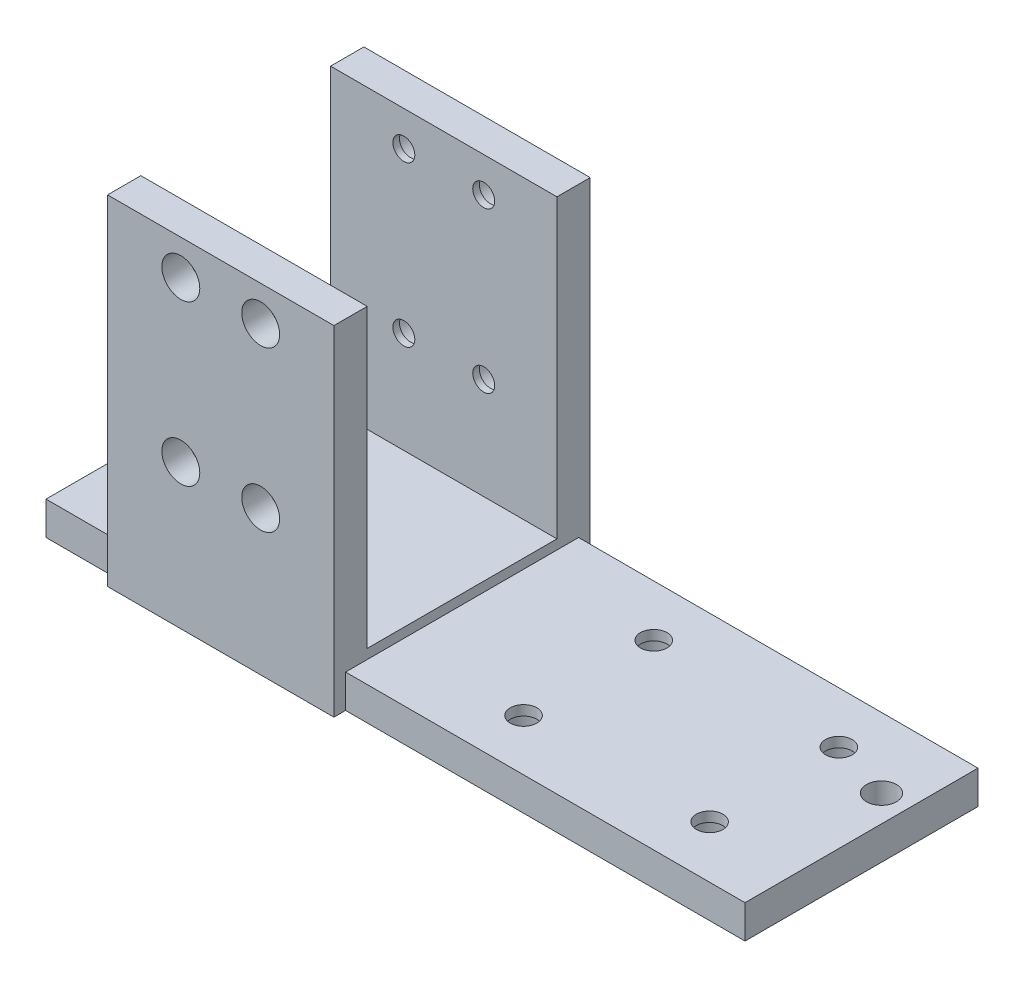
from build123d import *

# Parameters (mm, degrees)
SKETCH1_W                                      = 105
SKETCH1_H                                      = 35
BOSS_EXTRUDE1_DEPTH                            = 5
M4_CLEARANCE_HOLE1_D                           = 4.5
SKETCH4_W                                      = 33.2
SKETCH4_H                                      = 35
BOSS_EXTRUDE2_DEPTH                            = 1.45
BOSS_EXTRUDE3_DEPTH                            = 17
CBORE_FOR_M2_5_SHCS1_AT_2_COUNT                = 2
CBORE_FOR_M2_5_SHCS1_AT_2_PITCH                = 12
CBORE_FOR_M2_5_SHCS1_AT_3_COUNT                = 2
CBORE_FOR_M2_5_SHCS1_AT_3_PITCH                = 24
CBORE_FOR_M2_5_SHCS1_AT_4_COUNT                = 2
CBORE_FOR_M2_5_SHCS1_AT_4_PITCH                = 26.83281573
BOSS_EXTRUDE5_DEPTH                            = 0.4
BOSS_EXTRUDE6_DEPTH                            = 0.4
CBORE_FOR_6_SOCKET_HEAD_CAP_SCREW1_D           = 3.997300108
CBORE_FOR_6_SOCKET_HEAD_CAP_SCREW1_CBORE_D     = 7.345020108
CBORE_FOR_6_SOCKET_HEAD_CAP_SCREW1_CBORE_DEPTH = 3.5052


with BuildPart() as part:
    # Sketch1 → Boss-Extrude1 (new body)
    with BuildSketch(Plane(origin=(0, 0, 0), x_dir=(1, 0, 0), z_dir=(0, 1, 0))):
        Rectangle(SKETCH1_W, SKETCH1_H)
    extrude(amount=BOSS_EXTRUDE1_DEPTH)

    # M4 Clearance Hole1 (through all)
    with Locations(Plane(origin=(0, 5, 0), x_dir=(1, 0, 0), z_dir=(0, 1, 0))):
        with Locations((-48.5, 7), (48.5, 7)):
            Hole(M4_CLEARANCE_HOLE1_D / 2)

    # Sketch4 → Boss-Extrude2 (add)
    with BuildSketch(Plane(origin=(0, 5, 0), x_dir=(1, 0, 0), z_dir=(0, 1, 0))):
        with Locations((-24.5, 0)):
            Rectangle(SKETCH4_W, SKETCH4_H)
    extrude(amount=BOSS_EXTRUDE2_DEPTH)

    # Sketch5 → Boss-Extrude3 (add, symmetric)
    with BuildSketch(Plane.ZY.offset(24.5)):
        Polygon((-17.5, 0), (-19.25, 0), (-19.25, 50.95), (-14.25, 50.95), (-14.25, 6.45), (-17.5, 6.45), align=None)
    boss_extrude3 = extrude(amount=BOSS_EXTRUDE3_DEPTH, both=True)

    # Sketch9 → CBORE for M2.5 SHCS1 (revolve, cut)
    with BuildSketch(Plane(origin=(-30.5, 45.7, -19.25), x_dir=(0, 1, 0), z_dir=(1, 0, 0))):
        Polygon((0, 0), (0, 34.490420021), (1.65, 33.499), (1.65, 4), (2.85, 4), (2.85, 0), align=None)
    cbore_for_m2_5_shcs1 = revolve(axis=Axis((-30.5, 45.7, -25.6), (0, 0, 1)), mode=Mode.SUBTRACT)

    # CBORE for M2.5 SHCS1 at 2: CBORE for M2.5 SHCS1 ×2
    with Locations(*[(i * CBORE_FOR_M2_5_SHCS1_AT_2_PITCH, 0, 0) for i in range(1, CBORE_FOR_M2_5_SHCS1_AT_2_COUNT)]):
        add(cbore_for_m2_5_shcs1, mode=Mode.SUBTRACT)

    # CBORE for M2.5 SHCS1 at 3: CBORE for M2.5 SHCS1 ×2
    with Locations(*[(0, -i * CBORE_FOR_M2_5_SHCS1_AT_3_PITCH, 0) for i in range(1, CBORE_FOR_M2_5_SHCS1_AT_3_COUNT)]):
        add(cbore_for_m2_5_shcs1, mode=Mode.SUBTRACT)

    # CBORE for M2.5 SHCS1 at 4: CBORE for M2.5 SHCS1 ×2
    with Locations(*[Vector(0.44721359549995815, -0.8944271909999159, 0) * (i * CBORE_FOR_M2_5_SHCS1_AT_4_PITCH) for i in range(1, CBORE_FOR_M2_5_SHCS1_AT_4_COUNT)]):
        add(cbore_for_m2_5_shcs1, mode=Mode.SUBTRACT)

    # Mirror1: Boss-Extrude3, CBORE for M2.5 SHCS1 across plane
    add(boss_extrude3.mirror(Plane(origin=(0, 0, 0), x_dir=(1, 0, 0), z_dir=(0, 0, -1))))
    add(cbore_for_m2_5_shcs1.mirror(Plane(origin=(0, 0, 0), x_dir=(1, 0, 0), z_dir=(0, 0, -1))), mode=Mode.SUBTRACT)

    # Mirror1 copy 1 sketch → Mirror1 copy 1 (revolve, cut)
    with BuildSketch(Plane(origin=(-18.5, 45.7, 19.25), x_dir=(0, 1, 0), z_dir=(1, 0, 0))):
        Polygon((0, 0), (0, -34.490420021), (1.65, -33.499), (1.65, -4), (2.85, -4), (2.85, 0), align=None)
    revolve(axis=Axis((-18.5, 45.7, 25.6), (0, 0, 1)), mode=Mode.SUBTRACT)

    # Mirror1 copy 2 sketch → Mirror1 copy 2 (revolve, cut)
    with BuildSketch(Plane(origin=(-30.5, 21.7, 19.25), x_dir=(0, 1, 0), z_dir=(1, 0, 0))):
        Polygon((0, 0), (0, -34.490420021), (1.65, -33.499), (1.65, -4), (2.85, -4), (2.85, 0), align=None)
    revolve(axis=Axis((-30.5, 21.7, 25.6), (0, 0, 1)), mode=Mode.SUBTRACT)

    # Mirror1 copy 3 sketch → Mirror1 copy 3 (revolve, cut)
    with BuildSketch(Plane(origin=(-18.5, 21.7, 19.25), x_dir=(0, 1, 0), z_dir=(1, 0, 0))):
        Polygon((0, 0), (0, -34.490420021), (1.65, -33.499), (1.65, -4), (2.85, -4), (2.85, 0), align=None)
    revolve(axis=Axis((-18.5, 21.7, 25.6), (0, 0, 1)), mode=Mode.SUBTRACT)

    # Sketch11 → Boss-Extrude5 (add)
    with BuildSketch(Plane(origin=(-7.9, 0, 0), x_dir=(0, 0, -1), z_dir=(1, 0, 0))):
        Polygon((17.5, 5), (17.5, 6.45), (14.25, 6.45), (-14.25, 6.45), (-17.5, 6.45), (-17.5, 5), align=None)
    extrude(amount=BOSS_EXTRUDE5_DEPTH)

    # Sketch12 → Boss-Extrude6 (add)
    with BuildSketch(Plane.ZY.offset(41.1)):
        Polygon((17.5, 5), (17.5, 6.45), (14.25, 6.45), (-14.25, 6.45), (-17.5, 6.45), (-17.5, 5), align=None)
    extrude(amount=BOSS_EXTRUDE6_DEPTH)

    # CBORE for #6 Socket Head Cap Screw1 (through all)
    with Locations(Plane(origin=(0, 0, 0), x_dir=(-1, 0, 0), z_dir=(0, -1, 0))):
        with Locations((-39.325, 9.779), (-11.514, 9.779), (-39.325, -9.639687995), (-11.514, -9.779)):
            CounterBoreHole(CBORE_FOR_6_SOCKET_HEAD_CAP_SCREW1_D / 2, CBORE_FOR_6_SOCKET_HEAD_CAP_SCREW1_CBORE_D / 2, CBORE_FOR_6_SOCKET_HEAD_CAP_SCREW1_CBORE_DEPTH)


solid = part.part
